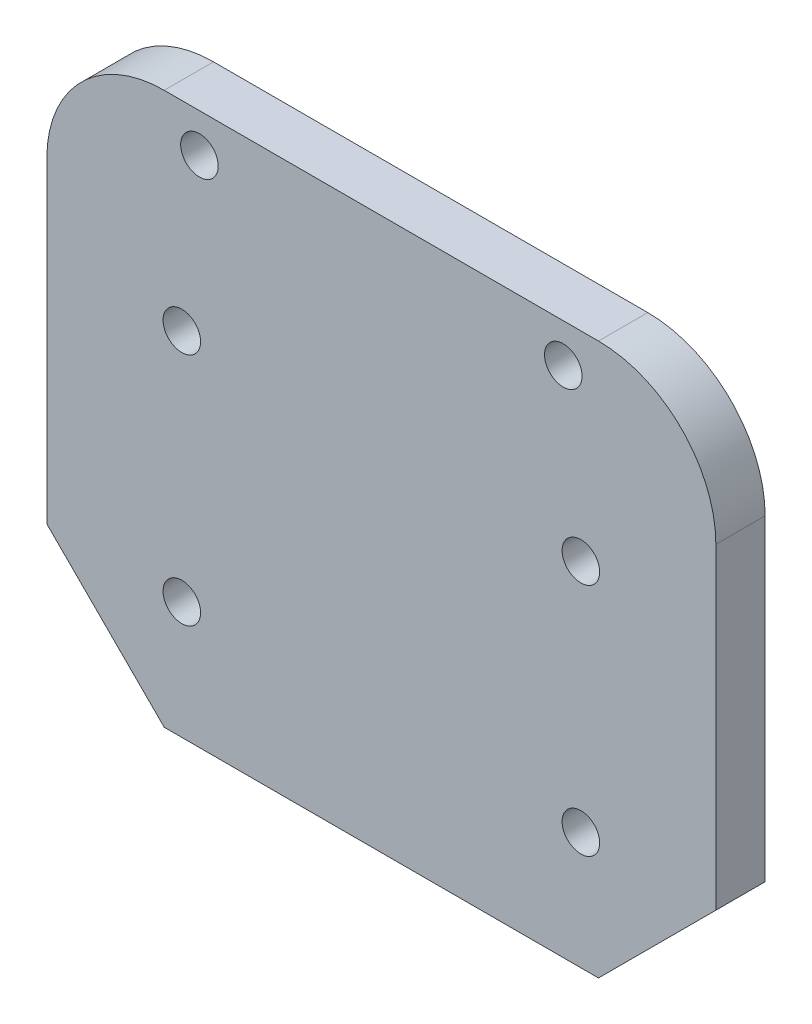
from build123d import *

# Parameters (mm, degrees)
SKETCH2_R           = 1.6
BOSS_EXTRUDE1_DEPTH = 4.2
CHAMFER1_SIZE       = 10


with BuildPart() as part:
    # Sketch2 → Boss-Extrude1 (new body)
    with BuildSketch(Plane(origin=(0, 0, 0), x_dir=(0, 1, 0), z_dir=(0, 0, 1))):
        with BuildLine():
            Line((0, 0), (37, 0))
            ThreePointArc((37, 0), (44.071067812, 2.928932188), (47, 10))
            Line((47, 10), (47, 47))
            ThreePointArc((47, 47), (44.071067812, 54.071067812), (37, 57))
            Line((37, 57), (0, 57))
            Line((0, 57), (0, 0))
        make_face()
        with Locations(Location((43.7, 44, 0), (0, 0, 270))):
            Circle(SKETCH2_R, mode=Mode.SUBTRACT)
        with Locations(Location((43.7, 13, 0), (0, 0, 270))):
            Circle(SKETCH2_R, mode=Mode.SUBTRACT)
        with Locations(Location((10, 45.5, 0), (0, 0, 270))):
            Circle(SKETCH2_R, mode=Mode.SUBTRACT)
        with Locations(Location((10, 11.5, 0), (0, 0, 270))):
            Circle(SKETCH2_R, mode=Mode.SUBTRACT)
        with Locations(Location((30, 45.5, 0), (0, 0, 270))):
            Circle(SKETCH2_R, mode=Mode.SUBTRACT)
        with Locations(Location((30, 11.5, 0), (0, 0, 270))):
            Circle(SKETCH2_R, mode=Mode.SUBTRACT)
    extrude(amount=BOSS_EXTRUDE1_DEPTH)

    # Chamfer1
    chamfer1_edges = [part.edges().sort_by_distance(p)[0] for p in [
        (-57, 0, 2.1),
        (0, 0, 2.1),
    ]]
    chamfer(chamfer1_edges, length=CHAMFER1_SIZE)


solid = part.part
